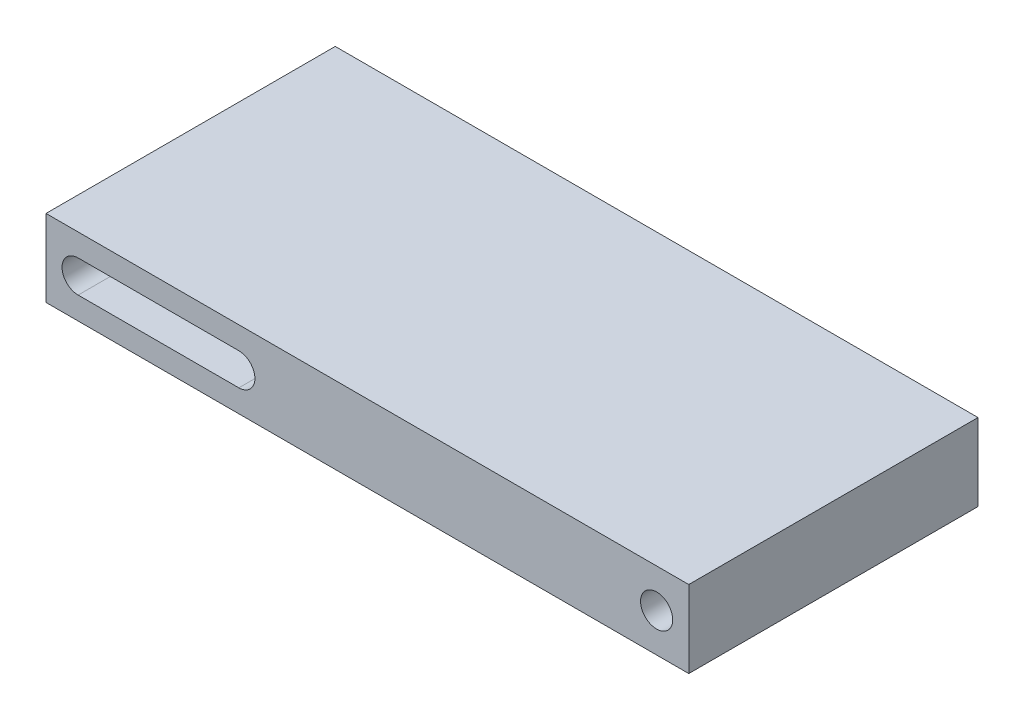
from build123d import *

# Parameters (mm, degrees)
SKETCH1_W           = 100
SKETCH1_H           = 45
BOSS_EXTRUDE2_DEPTH = 6
SKETCH3_R           = 2.5
CUT_EXTRUDE1_DEPTH  = 68.53517602


with BuildPart() as part:
    # Sketch1 → Boss-Extrude2 (new, symmetric)
    with BuildSketch(Plane(origin=(0, 0, 0), x_dir=(1, 0, 0), z_dir=(0, 1, 0))):
        Rectangle(SKETCH1_W, SKETCH1_H)
    extrude(amount=BOSS_EXTRUDE2_DEPTH, both=True)

    # Sketch3 → Cut-Extrude1 (cut, through all)
    with BuildSketch(Plane.XY.offset(22.5)):
        with Locations((45, 0)):
            Circle(SKETCH3_R)
        with BuildLine():
            Line((-45, 2.5), (-20, 2.5))
            ThreePointArc((-20, 2.5), (-17.5, 0), (-20, -2.5))
            Line((-20, -2.5), (-45, -2.5))
            ThreePointArc((-45, -2.5), (-47.5, 0), (-45, 2.5))
        make_face()
    extrude(amount=-CUT_EXTRUDE1_DEPTH, mode=Mode.SUBTRACT)


solid = part.part
